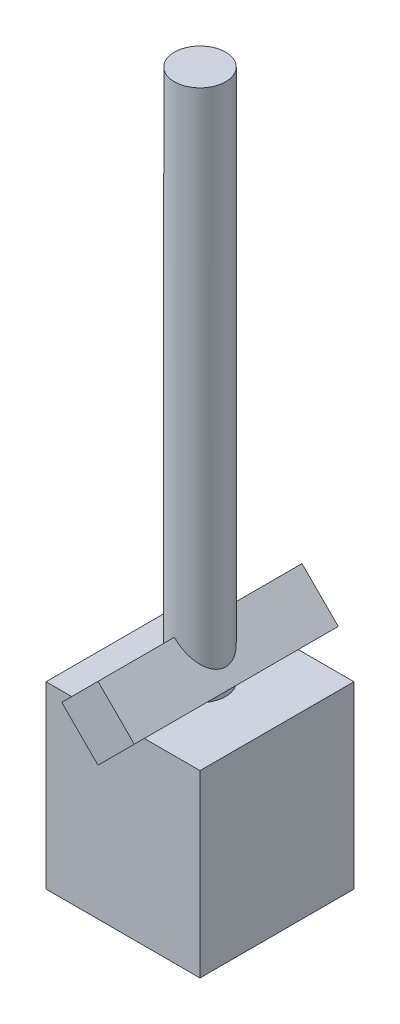
from build123d import *

# Parameters (mm, degrees)
BOSS_EXTRUDE1_DEPTH = 15.9
SKETCH2_W           = 24
SKETCH2_H           = 28
BOSS_EXTRUDE2_DEPTH = 12
BOSS_EXTRUDE3_START = -8
SKETCH3_R           = 4
BOSS_EXTRUDE3_DEPTH = 83


with BuildPart() as part:
    # Sketch1 → Boss-Extrude1 (new, symmetric)
    with BuildSketch(Plane.XY):
        Polygon((0, 0), (5.656854249, -5.656854249), (0, -11.313708499), (-5.656854249, -5.656854249), align=None)
    extrude(amount=BOSS_EXTRUDE1_DEPTH, both=True)

    # Sketch2 → Boss-Extrude2 (add, symmetric)
    with BuildSketch(Plane.XY):
        with Locations((0, -22)):
            Rectangle(SKETCH2_W, SKETCH2_H)
    extrude(amount=BOSS_EXTRUDE2_DEPTH, both=True)

    # Sketch3 → Boss-Extrude3 (add)
    with BuildSketch(Plane(origin=(0, 0, 0), x_dir=(1, 0, 0), z_dir=(0, 1, 0)).offset(BOSS_EXTRUDE3_START)):
        with Locations(Location((0, 0, 0), (0, 0, 270))):
            Circle(SKETCH3_R)
    extrude(amount=BOSS_EXTRUDE3_DEPTH)


solid = part.part
